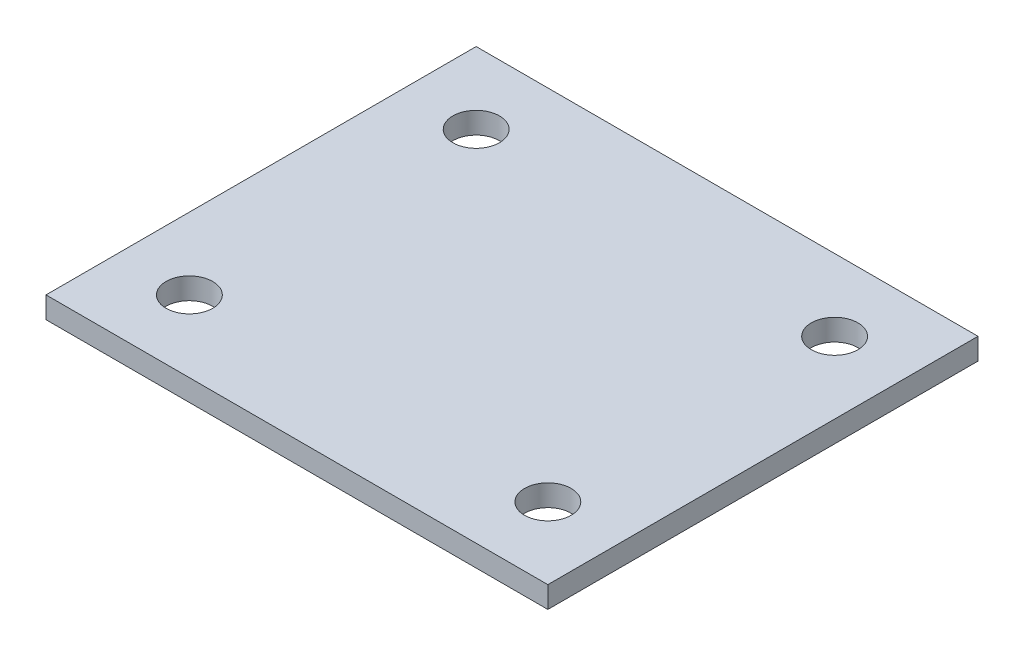
from build123d import *

# Parameters (mm, degrees)
SZKIC1_W                    = 70
SZKIC1_H                    = 60
SZKIC1_R                    = 3.25
DODANIE_WYCI_GNI_CIE1_DEPTH = 3


with BuildPart() as part:
    # Szkic1 → Dodanie-wyciągnięcie1 (new body)
    with BuildSketch(Plane(origin=(0, 0, 0), x_dir=(1, 0, 0), z_dir=(0, 1, 0))):
        with Locations((35, 30)):
            Rectangle(SZKIC1_W, SZKIC1_H)
        with Locations(Location((10, 10, 0), (0, 0, 270))):
            Circle(SZKIC1_R, mode=Mode.SUBTRACT)
        with Locations(Location((60, 10, 0), (0, 0, 270))):
            Circle(SZKIC1_R, mode=Mode.SUBTRACT)
        with Locations(Location((60, 50, 0), (0, 0, 270))):
            Circle(SZKIC1_R, mode=Mode.SUBTRACT)
        with Locations(Location((10, 50, 0), (0, 0, 270))):
            Circle(SZKIC1_R, mode=Mode.SUBTRACT)
    extrude(amount=DODANIE_WYCI_GNI_CIE1_DEPTH)


solid = part.part
